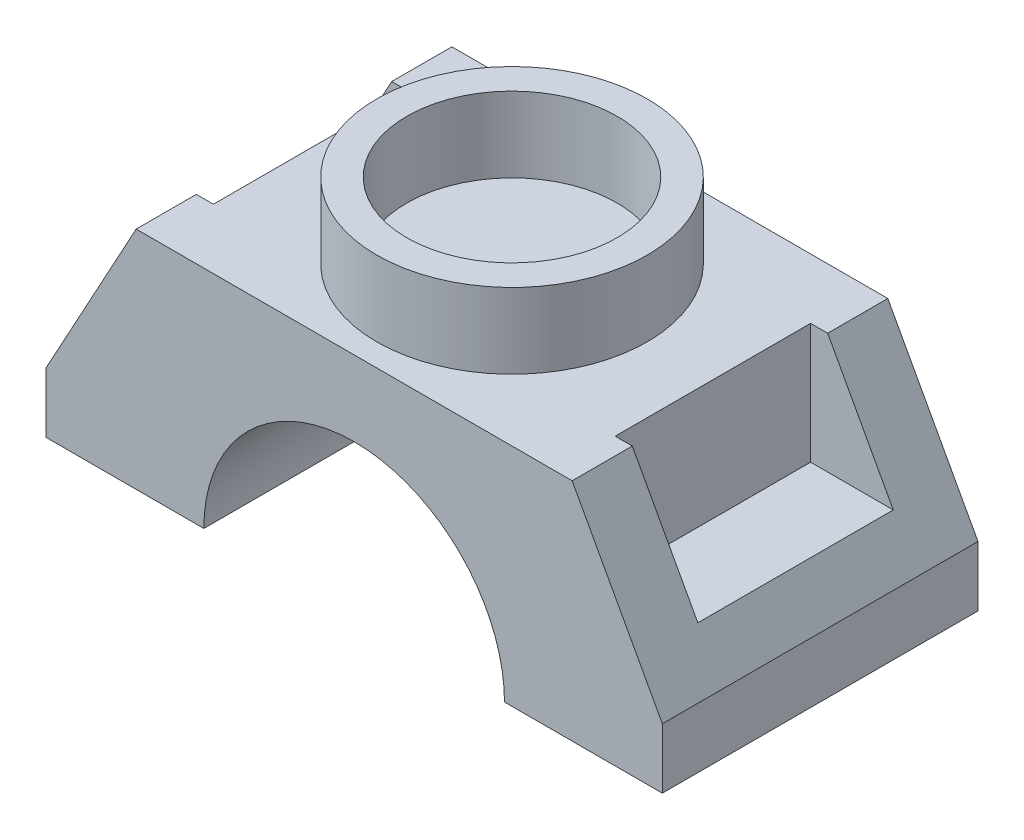
from build123d import *

# Parameters (mm, degrees)
BOSS_EXTRUDE1_DEPTH = 42
SKETCH2_R           = 18
SKETCH2_R_2         = 14
BOSS_EXTRUDE2_DEPTH = 10
CUT_EXTRUDE1_DEPTH  = 26


with BuildPart() as part:
    # Sketch1 → Boss-Extrude1 (new body)
    with BuildSketch(Plane.XY):
        with BuildLine():
            Line((-30.817923278, 0), (-30.817923278, 8))
            Line((-30.817923278, 8), (-18.817923278, 30))
            Line((-18.817923278, 30), (39.182076722, 30))
            Line((39.182076722, 30), (51.182076722, 8))
            Line((51.182076722, 8), (51.182076722, 0))
            Line((51.182076722, 0), (30.182076722, 0))
            ThreePointArc((30.182076722, 0), (10.182076722, 20), (-9.817923278, 0))
            Line((-9.817923278, 0), (-30.817923278, 0))
        make_face()
    extrude(amount=-BOSS_EXTRUDE1_DEPTH)

    # Sketch2 → Boss-Extrude2 (add)
    with BuildSketch(Plane(origin=(0, 30, 0), x_dir=(1, 0, 0), z_dir=(0, 1, 0))):
        with Locations(Location((10.182076722, 21, 0), (0, 0, 270))):
            Circle(SKETCH2_R)
        with Locations(Location((10.182076722, 21, 0), (0, 0, 270))):
            Circle(SKETCH2_R_2, mode=Mode.SUBTRACT)
    extrude(amount=BOSS_EXTRUDE2_DEPTH)

    # Sketch3 → Cut-Extrude1 (cut)
    with BuildSketch(Plane.XY.offset(-8)):
        Polygon((36.909349449, 30), (36.909349449, 14), (47.909349449, 14), (39.182076722, 30), align=None)
        Polygon((-16.545196006, 30), (-16.545196006, 14), (-27.545196006, 14), (-18.817923278, 30), align=None)
    extrude(amount=-CUT_EXTRUDE1_DEPTH, mode=Mode.SUBTRACT)


solid = part.part
